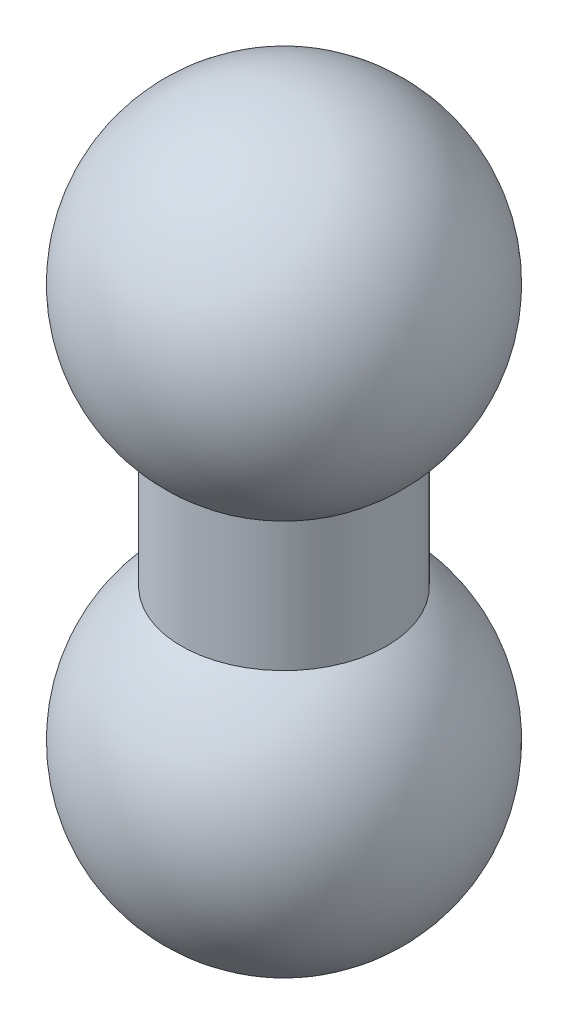
from build123d import *


with BuildPart() as part:
    # Sketch1 → Revolve-Thin2 (revolve)
    with BuildSketch(Plane.XY, mode=Mode.PRIVATE) as revolve_thin2_sk:
        with BuildLine():
            ThreePointArc((0, 44.45), (18.216396806, 30.973633231), (10.659476597, 9.611457994))
            Line((10.659476597, 9.611457994), (10.659476597, -9.611457994))
            ThreePointArc((10.659476597, -9.611457994), (18.216396806, -30.973633231), (0, -44.45))
            Line((0, -44.45), (0, -46.99))
            ThreePointArc((0, -46.99), (20.432770431, -32.373520813), (13.199476597, -8.314862671))
            Line((13.199476597, -8.314862671), (13.199476597, 8.314862671))
            ThreePointArc((13.199476597, 8.314862671), (20.432770431, 32.373520813), (0, 46.99))
            Line((0, 46.99), (0, 44.45))
        make_face()
    revolve(revolve_thin2_sk.sketch.rotate(Axis((0, 50.010285717, 0), (0, -1, 0)), 180), axis=Axis((0, 50.010285717, 0), (0, -1, 0)))


solid = part.part
